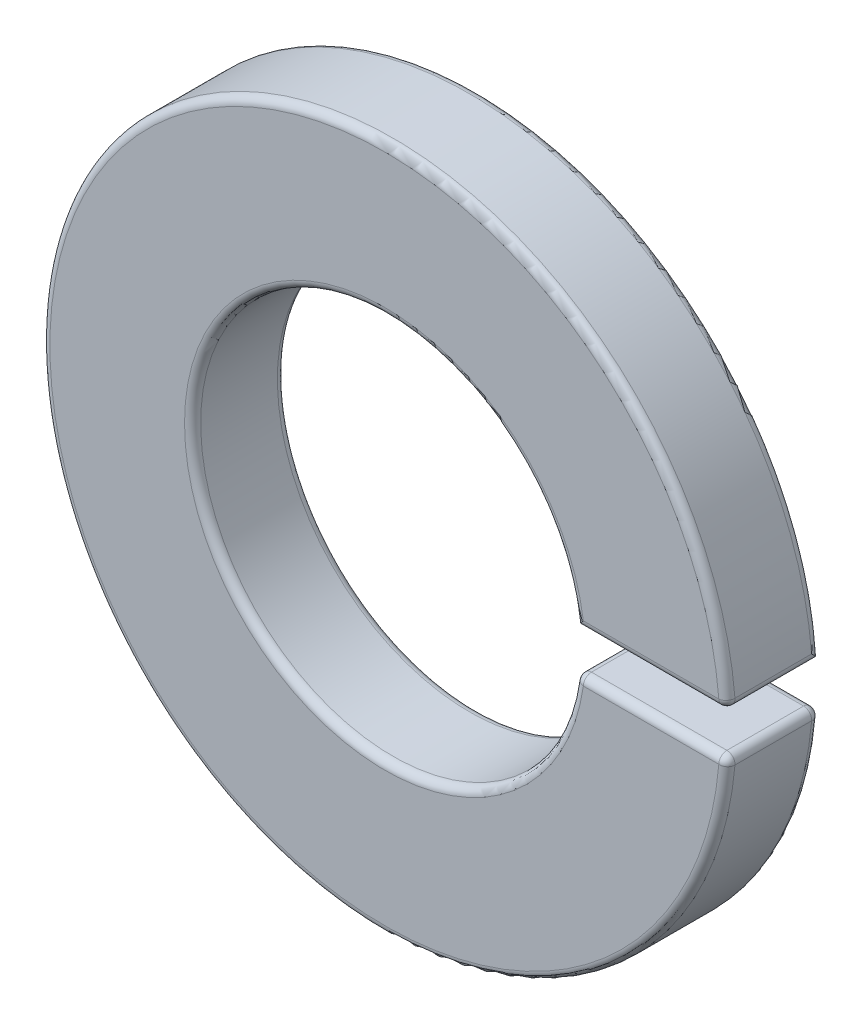
from build123d import *

# Parameters (mm, degrees)
RESSALTO_EXTRUS_O1_DEPTH = 2.3
FILETE1_R                = 0.2


with BuildPart() as part:
    # Esboço1 → Ressalto-extrusão1 (new body)
    with BuildSketch(Plane.XY):
        with BuildLine():
            Line((4.73869444, 0.5), (8.485281374, 0.5))
            ThreePointArc((8.485281374, 0.5), (-8.5, 0), (8.485281374, -0.5))
            Line((8.485281374, -0.5), (4.73869444, -0.5))
            ThreePointArc((4.73869444, -0.5), (-4.765, 0), (4.73869444, 0.5))
        make_face()
    extrude(amount=RESSALTO_EXTRUS_O1_DEPTH)

    # Filete1
    filete1_edges = [part.edges().sort_by_distance(p)[0] for p in [
        (-8.5, 0, 2.3),
        (6.611987907, -0.5, 2.3),
        (-4.765, 0, 2.3),
        (6.611987907, -0.5, 0),
        (-8.5, 0, 0),
        (-4.765, 0, 0),
        (6.611987907, 0.5, 2.3),
        (4.73869444, -0.5, 1.15),
        (8.485281374, -0.5, 1.15),
        (8.485281374, 0.5, 1.15),
    ]]
    fillet(filete1_edges, radius=FILETE1_R)


solid = part.part
